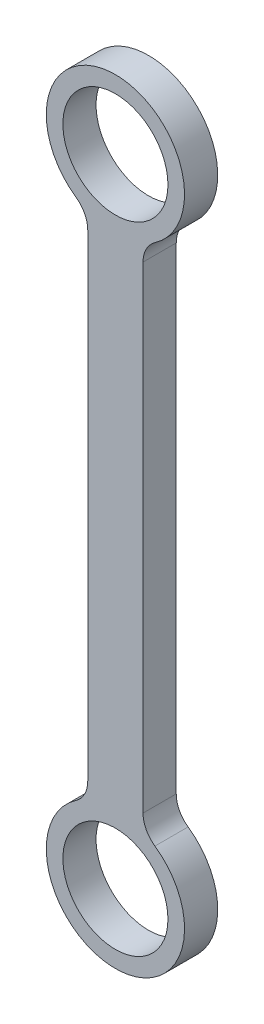
from build123d import *

# Parameters (mm, degrees)
SALIENTE_EXTRUIR1_DEPTH = 6
REDONDEO1_R             = 5


with BuildPart() as part:
    # Croquis1 → Saliente-Extruir1 (new body)
    with BuildSketch(Plane.XY):
        with BuildLine():
            ThreePointArc((-5, 103.543560763), (0, 102.5), (5, 103.543560763))
            Line((5, 103.543560763), (5, 106.922252789))
            ThreePointArc((5, 106.922252789), (0, 105.5), (-5, 106.922252789))
            Line((-5, 106.922252789), (-5, 103.543560763))
        make_face()
        with BuildLine():
            Line((5, 106.922252789), (5, 103.543560763))
            ThreePointArc((5, 103.543560763), (10.458250332, 108.153468031), (12.5, 115))
            ThreePointArc((12.5, 115), (-6.846531969, 125.458250332), (-5, 103.543560763))
            Line((-5, 103.543560763), (-5, 106.922252789))
            ThreePointArc((-5, 106.922252789), (-4.623310502, 123.299096336), (9.5, 115))
            ThreePointArc((9.5, 115), (8.299096336, 110.376689498), (5, 106.922252789))
        make_face()
        with BuildLine():
            ThreePointArc((-5, 11.456439237), (0, 12.5), (5, 11.456439237))
            Line((5, 11.456439237), (5, 103.543560763))
            ThreePointArc((5, 103.543560763), (0, 102.5), (-5, 103.543560763))
            Line((-5, 103.543560763), (-5, 11.456439237))
        make_face()
        with BuildLine():
            ThreePointArc((-5, 8.077747211), (0, 9.5), (5, 8.077747211))
            Line((5, 8.077747211), (5, 11.456439237))
            ThreePointArc((5, 11.456439237), (0, 12.5), (-5, 11.456439237))
            Line((-5, 11.456439237), (-5, 8.077747211))
        make_face()
        with BuildLine():
            Line((5, 11.456439237), (5, 8.077747211))
            ThreePointArc((5, 8.077747211), (8.299096336, 4.623310502), (9.5, 0))
            ThreePointArc((9.5, 0), (-4.623310502, -8.299096336), (-5, 8.077747211))
            Line((-5, 8.077747211), (-5, 11.456439237))
            ThreePointArc((-5, 11.456439237), (-6.846531969, -10.458250332), (12.5, 0))
            ThreePointArc((12.5, 0), (10.458250332, 6.846531969), (5, 11.456439237))
        make_face()
    extrude(amount=SALIENTE_EXTRUIR1_DEPTH)

    # Redondeo1
    redondeo1_edges = [part.edges().sort_by_distance(p)[0] for p in [
        (-5, 11.456439237, 3),
        (-5, 103.543560763, 3),
        (5, 103.543560763, 3),
        (5, 11.456439237, 3),
    ]]
    fillet(redondeo1_edges, radius=REDONDEO1_R)


solid = part.part
